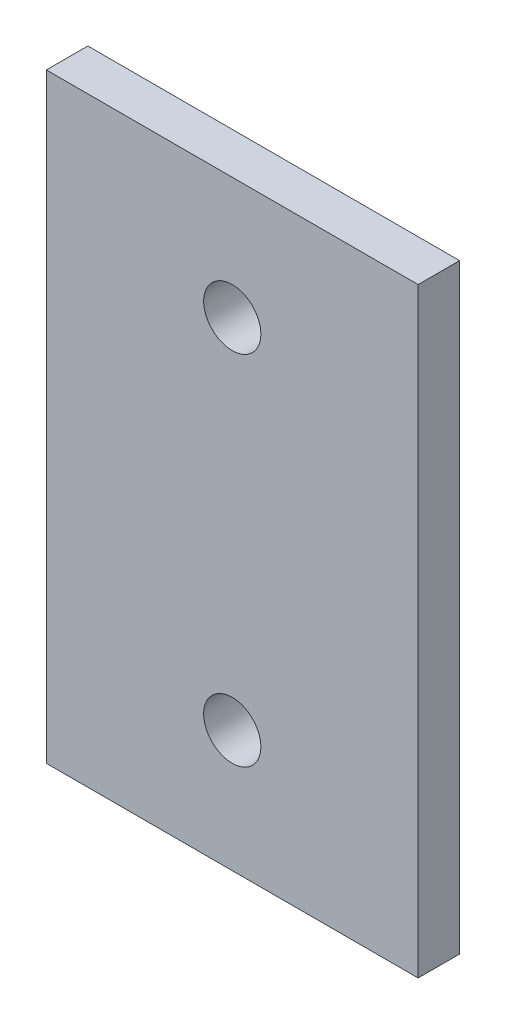
from build123d import *

# Parameters (mm, degrees)
SKETCH_1_W      = 52
SKETCH_1_H      = 84
SKETCH_1_R      = 4
EXTRUDE_1_DEPTH = 5.8


with BuildPart() as part:
    # Эскиз1 → Бобышка-Вытянуть1 (new body)
    with BuildSketch(Plane.XY):
        with Locations((26, 42)):
            Rectangle(SKETCH_1_W, SKETCH_1_H)
        with Locations((26, 67)):
            Circle(SKETCH_1_R, mode=Mode.SUBTRACT)
        with Locations((26, 17)):
            Circle(SKETCH_1_R, mode=Mode.SUBTRACT)
    extrude(amount=EXTRUDE_1_DEPTH)


solid = part.part
